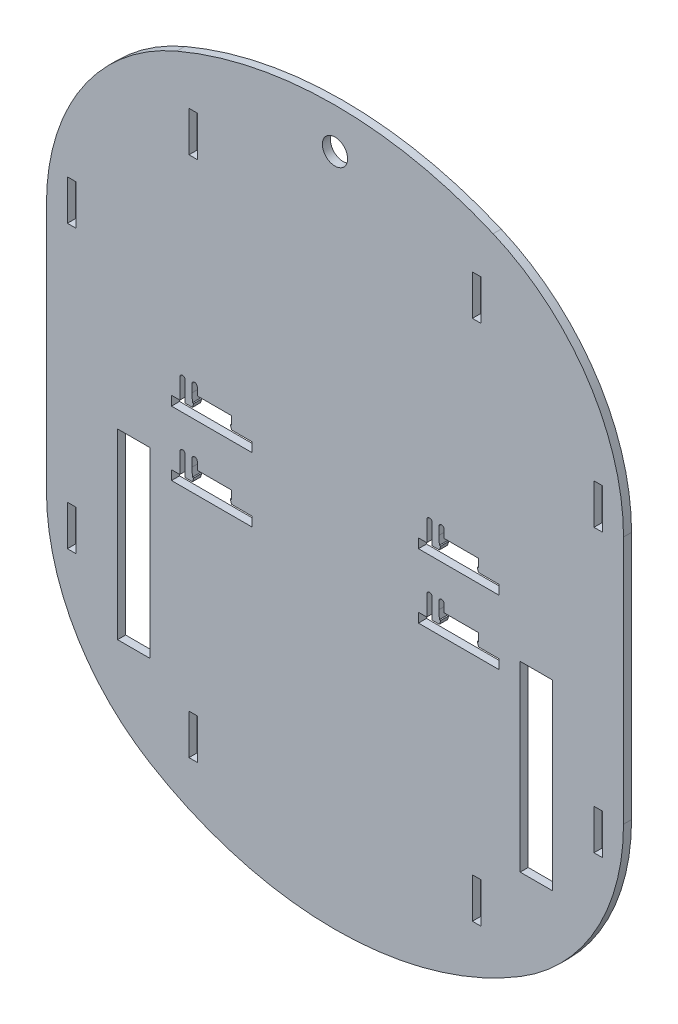
from build123d import *

# Parameters (mm, degrees)
BOSS_EXTRUDE1_DEPTH          = 3
MOUNTING_SLOTS_REACH         = 173.039
SKETCH2_W                    = 3.2
SKETCH2_H                    = 15
CASTER_AND_WHEEL_SLOTS_REACH = 173.039
SKETCH3_R                    = 4.7
SKETCH3_W                    = 12
SKETCH3_H                    = 68


with BuildPart() as part:
    # Sketch1 → Boss-Extrude1 (new body)
    with BuildSketch(Plane.XY):
        with BuildLine():
            Line((-107.5, -45.307284183), (-107.5, 47.371965948))
            ThreePointArc((-107.5, 47.371965948), (-94.261836832, 91.449819149), (-58.928571429, 120.939927031))
            ThreePointArc((-58.928571429, 120.939927031), (0, 133), (58.928571429, 120.939927031))
            ThreePointArc((58.928571429, 120.939927031), (94.261836832, 91.449819149), (107.5, 47.371965948))
            Line((107.5, 47.371965948), (107.5, -45.307284183))
            ThreePointArc((107.5, -45.307284183), (97.216406667, -84.545309636), (69.009433962, -113.695637666))
            ThreePointArc((69.009433962, -113.695637666), (0, -133), (-69.009433962, -113.695637666))
            ThreePointArc((-69.009433962, -113.695637666), (-97.216406667, -84.545309636), (-107.5, -45.307284183))
        make_face()
    extrude(amount=BOSS_EXTRUDE1_DEPTH)

    # Sketch2 → mounting slots (cut, up to next)
    with BuildSketch(Plane.XY.offset(3), mode=Mode.PRIVATE) as mounting_slots_sk1:
        with Locations((98.1, -52.5)):
            Rectangle(SKETCH2_W, SKETCH2_H)
    mounting_slots_tool1 = extrude(mounting_slots_sk1.sketch, amount=-MOUNTING_SLOTS_REACH, mode=Mode.PRIVATE) & part.part
    # Sketch2 → mounting slots (cut, up to next)
    with BuildSketch(Plane.XY.offset(3), mode=Mode.PRIVATE) as mounting_slots_sk2:
        with Locations((98.1, 52.5)):
            Rectangle(SKETCH2_W, SKETCH2_H)
    mounting_slots_tool2 = extrude(mounting_slots_sk2.sketch, amount=-MOUNTING_SLOTS_REACH, mode=Mode.PRIVATE) & part.part
    # Sketch2 → mounting slots (cut, up to next)
    with BuildSketch(Plane.XY.offset(3), mode=Mode.PRIVATE) as mounting_slots_sk3:
        with Locations((-98.1, 52.5)):
            Rectangle(SKETCH2_W, SKETCH2_H)
    mounting_slots_tool3 = extrude(mounting_slots_sk3.sketch, amount=-MOUNTING_SLOTS_REACH, mode=Mode.PRIVATE) & part.part
    # Sketch2 → mounting slots (cut, up to next)
    with BuildSketch(Plane.XY.offset(3), mode=Mode.PRIVATE) as mounting_slots_sk4:
        with Locations((-98.1, -52.5)):
            Rectangle(SKETCH2_W, SKETCH2_H)
    mounting_slots_tool4 = extrude(mounting_slots_sk4.sketch, amount=-MOUNTING_SLOTS_REACH, mode=Mode.PRIVATE) & part.part
    # Sketch2 → mounting slots (cut, up to next)
    with BuildSketch(Plane.XY.offset(3), mode=Mode.PRIVATE) as mounting_slots_sk5:
        with Locations((52.79, 97.254160418)):
            Rectangle(SKETCH2_W, SKETCH2_H)
    mounting_slots_tool5 = extrude(mounting_slots_sk5.sketch, amount=-MOUNTING_SLOTS_REACH, mode=Mode.PRIVATE) & part.part
    # Sketch2 → mounting slots (cut, up to next)
    with BuildSketch(Plane.XY.offset(3), mode=Mode.PRIVATE) as mounting_slots_sk6:
        with Locations((52.79, -97.254160418)):
            Rectangle(SKETCH2_W, SKETCH2_H)
    mounting_slots_tool6 = extrude(mounting_slots_sk6.sketch, amount=-MOUNTING_SLOTS_REACH, mode=Mode.PRIVATE) & part.part
    # Sketch2 → mounting slots (cut, up to next)
    with BuildSketch(Plane.XY.offset(3), mode=Mode.PRIVATE) as mounting_slots_sk7:
        with Locations((-52.79, 97.254160418)):
            Rectangle(SKETCH2_W, SKETCH2_H)
    mounting_slots_tool7 = extrude(mounting_slots_sk7.sketch, amount=-MOUNTING_SLOTS_REACH, mode=Mode.PRIVATE) & part.part
    # Sketch2 → mounting slots (cut, up to next)
    with BuildSketch(Plane.XY.offset(3), mode=Mode.PRIVATE) as mounting_slots_sk8:
        with Locations((-52.79, -97.254160418)):
            Rectangle(SKETCH2_W, SKETCH2_H)
    mounting_slots_tool8 = extrude(mounting_slots_sk8.sketch, amount=-MOUNTING_SLOTS_REACH, mode=Mode.PRIVATE) & part.part
    # Sketch2 → mounting slots (cut, up to next)
    with BuildSketch(Plane.XY.offset(3), mode=Mode.PRIVATE) as mounting_slots_sk9:
        with BuildLine():
            Line((31.1, -18.6), (61.1, -18.6))
            Line((61.1, -18.6), (61.1, -15.1))
            Line((61.1, -15.1), (53.5, -15.1))
            Line((53.5, -15.1), (53, -13.6))
            Line((53, -13.6), (53.5, -13.6))
            Line((53.5, -13.6), (53.5, -10.5))
            Line((53.5, -10.5), (40.7, -10.5))
            Line((40.7, -10.5), (40.7, -7.6))
            ThreePointArc((40.7, -7.6), (39.7, -6.6), (38.7, -7.6))
            Line((38.7, -7.6), (38.7, -10.5))
            Line((38.7, -10.5), (38.9, -13.6))
            Line((38.9, -13.6), (39.4, -13.6))
            Line((39.4, -13.6), (38.9, -15.1))
            Line((38.9, -15.1), (36.2, -15.1))
            Line((36.2, -15.1), (36.2, -7.6))
            ThreePointArc((36.2, -7.6), (35.2, -6.6), (34.2, -7.6))
            Line((34.2, -7.6), (34.2, -15.1))
            Line((34.2, -15.1), (31.1, -15.1))
            Line((31.1, -15.1), (31.1, -18.6))
        make_face()
    mounting_slots_tool9 = extrude(mounting_slots_sk9.sketch, amount=-MOUNTING_SLOTS_REACH, mode=Mode.PRIVATE) & part.part
    # Sketch2 → mounting slots (cut, up to next)
    with BuildSketch(Plane.XY.offset(3), mode=Mode.PRIVATE) as mounting_slots_sk10:
        with BuildLine():
            Line((31.1, 5.4), (61.1, 5.4))
            Line((61.1, 5.4), (61.1, 8.9))
            Line((61.1, 8.9), (53.5, 8.9))
            Line((53.5, 8.9), (53, 10.4))
            Line((53, 10.4), (53.5, 10.4))
            Line((53.5, 10.4), (53.5, 13.5))
            Line((53.5, 13.5), (40.7, 13.5))
            Line((40.7, 13.5), (40.7, 16.4))
            ThreePointArc((40.7, 16.4), (39.7, 17.4), (38.7, 16.4))
            Line((38.7, 16.4), (38.7, 13.5))
            Line((38.7, 13.5), (38.9, 10.4))
            Line((38.9, 10.4), (39.4, 10.4))
            Line((39.4, 10.4), (38.9, 8.9))
            Line((38.9, 8.9), (36.2, 8.9))
            Line((36.2, 8.9), (36.2, 16.4))
            ThreePointArc((36.2, 16.4), (35.2, 17.4), (34.2, 16.4))
            Line((34.2, 16.4), (34.2, 8.9))
            Line((34.2, 8.9), (31.1, 8.9))
            Line((31.1, 8.9), (31.1, 5.4))
        make_face()
    mounting_slots_tool10 = extrude(mounting_slots_sk10.sketch, amount=-MOUNTING_SLOTS_REACH, mode=Mode.PRIVATE) & part.part
    # Sketch2 → mounting slots (cut, up to next)
    with BuildSketch(Plane.XY.offset(3), mode=Mode.PRIVATE) as mounting_slots_sk11:
        with BuildLine():
            Line((-60.9, -18.6), (-30.9, -18.6))
            Line((-30.9, -18.6), (-30.9, -15.1))
            Line((-30.9, -15.1), (-38.5, -15.1))
            Line((-38.5, -15.1), (-39, -13.6))
            Line((-39, -13.6), (-38.5, -13.6))
            Line((-38.5, -13.6), (-38.5, -10.5))
            Line((-38.5, -10.5), (-51.3, -10.5))
            Line((-51.3, -10.5), (-51.3, -7.6))
            ThreePointArc((-51.3, -7.6), (-52.3, -6.6), (-53.3, -7.6))
            Line((-53.3, -7.6), (-53.3, -10.5))
            Line((-53.3, -10.5), (-53.1, -13.6))
            Line((-53.1, -13.6), (-52.6, -13.6))
            Line((-52.6, -13.6), (-53.1, -15.1))
            Line((-53.1, -15.1), (-55.8, -15.1))
            Line((-55.8, -15.1), (-55.8, -7.6))
            ThreePointArc((-55.8, -7.6), (-56.8, -6.6), (-57.8, -7.6))
            Line((-57.8, -7.6), (-57.8, -15.1))
            Line((-57.8, -15.1), (-60.9, -15.1))
            Line((-60.9, -15.1), (-60.9, -18.6))
        make_face()
    mounting_slots_tool11 = extrude(mounting_slots_sk11.sketch, amount=-MOUNTING_SLOTS_REACH, mode=Mode.PRIVATE) & part.part
    # Sketch2 → mounting slots (cut, up to next)
    with BuildSketch(Plane.XY.offset(3), mode=Mode.PRIVATE) as mounting_slots_sk12:
        with BuildLine():
            Line((-60.9, 5.4), (-30.9, 5.4))
            Line((-30.9, 5.4), (-30.9, 8.9))
            Line((-30.9, 8.9), (-38.5, 8.9))
            Line((-38.5, 8.9), (-39, 10.4))
            Line((-39, 10.4), (-38.5, 10.4))
            Line((-38.5, 10.4), (-38.5, 13.5))
            Line((-38.5, 13.5), (-51.3, 13.5))
            Line((-51.3, 13.5), (-51.3, 16.4))
            ThreePointArc((-51.3, 16.4), (-52.3, 17.4), (-53.3, 16.4))
            Line((-53.3, 16.4), (-53.3, 13.5))
            Line((-53.3, 13.5), (-53.1, 10.4))
            Line((-53.1, 10.4), (-52.6, 10.4))
            Line((-52.6, 10.4), (-53.1, 8.9))
            Line((-53.1, 8.9), (-55.8, 8.9))
            Line((-55.8, 8.9), (-55.8, 16.4))
            ThreePointArc((-55.8, 16.4), (-56.8, 17.4), (-57.8, 16.4))
            Line((-57.8, 16.4), (-57.8, 8.9))
            Line((-57.8, 8.9), (-60.9, 8.9))
            Line((-60.9, 8.9), (-60.9, 5.4))
        make_face()
    mounting_slots_tool12 = extrude(mounting_slots_sk12.sketch, amount=-MOUNTING_SLOTS_REACH, mode=Mode.PRIVATE) & part.part
    add(mounting_slots_tool1.solids().sort_by_distance((98.1, -52.5, 3))[0], mode=Mode.SUBTRACT)
    add(mounting_slots_tool2.solids().sort_by_distance((98.1, 52.5, 3))[0], mode=Mode.SUBTRACT)
    add(mounting_slots_tool3.solids().sort_by_distance((-98.1, 52.5, 3))[0], mode=Mode.SUBTRACT)
    add(mounting_slots_tool4.solids().sort_by_distance((-98.1, -52.5, 3))[0], mode=Mode.SUBTRACT)
    add(mounting_slots_tool5.solids().sort_by_distance((52.79, 97.25416, 3))[0], mode=Mode.SUBTRACT)
    add(mounting_slots_tool6.solids().sort_by_distance((52.79, -97.25416, 3))[0], mode=Mode.SUBTRACT)
    add(mounting_slots_tool7.solids().sort_by_distance((-52.79, 97.25416, 3))[0], mode=Mode.SUBTRACT)
    add(mounting_slots_tool8.solids().sort_by_distance((-52.79, -97.25416, 3))[0], mode=Mode.SUBTRACT)
    add(mounting_slots_tool9.solids().sort_by_distance((44.9582, -14.653776, 3))[0], mode=Mode.SUBTRACT)
    add(mounting_slots_tool10.solids().sort_by_distance((44.9582, 9.346224, 3))[0], mode=Mode.SUBTRACT)
    add(mounting_slots_tool11.solids().sort_by_distance((-47.0418, -14.653776, 3))[0], mode=Mode.SUBTRACT)
    add(mounting_slots_tool12.solids().sort_by_distance((-47.0418, 9.346224, 3))[0], mode=Mode.SUBTRACT)

    # Sketch3 → caster and wheel slots (cut, up to next)
    with BuildSketch(Plane.XY.offset(3), mode=Mode.PRIVATE) as caster_and_wheel_slots_sk1:
        with Locations((0, 118)):
            Circle(SKETCH3_R)
    caster_and_wheel_slots_tool1 = extrude(caster_and_wheel_slots_sk1.sketch, amount=-CASTER_AND_WHEEL_SLOTS_REACH, mode=Mode.PRIVATE) & part.part
    # Sketch3 → caster and wheel slots (cut, up to next)
    with BuildSketch(Plane.XY.offset(3), mode=Mode.PRIVATE) as caster_and_wheel_slots_sk2:
        with Locations((75, -46)):
            Rectangle(SKETCH3_W, SKETCH3_H)
    caster_and_wheel_slots_tool2 = extrude(caster_and_wheel_slots_sk2.sketch, amount=-CASTER_AND_WHEEL_SLOTS_REACH, mode=Mode.PRIVATE) & part.part
    # Sketch3 → caster and wheel slots (cut, up to next)
    with BuildSketch(Plane.XY.offset(3), mode=Mode.PRIVATE) as caster_and_wheel_slots_sk3:
        with Locations((-75, -46)):
            Rectangle(SKETCH3_W, SKETCH3_H)
    caster_and_wheel_slots_tool3 = extrude(caster_and_wheel_slots_sk3.sketch, amount=-CASTER_AND_WHEEL_SLOTS_REACH, mode=Mode.PRIVATE) & part.part
    add(caster_and_wheel_slots_tool1.solids().sort_by_distance((0, 118, 3))[0], mode=Mode.SUBTRACT)
    add(caster_and_wheel_slots_tool2.solids().sort_by_distance((75, -46, 3))[0], mode=Mode.SUBTRACT)
    add(caster_and_wheel_slots_tool3.solids().sort_by_distance((-75, -46, 3))[0], mode=Mode.SUBTRACT)


solid = part.part
